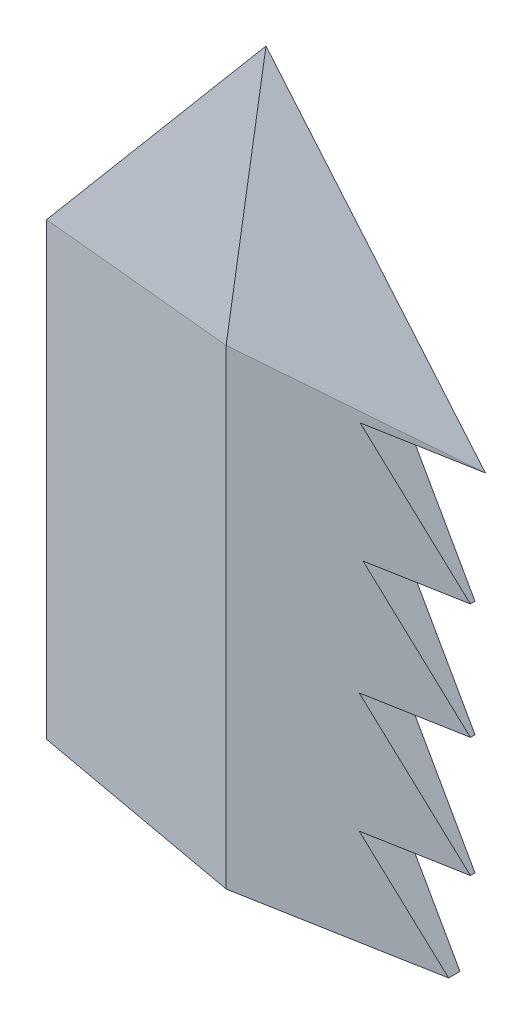
from build123d import *

# Parameters (mm, degrees)
BOSS_EXTRUDE1_DEPTH      = 9.525
BOSS_EXTRUDE1_DEPTH_BACK = 9.525
CUT_EXTRUDE1_DEPTH       = 373.680910299
CUT_EXTRUDE2_DEPTH       = 373.680910299
SKETCH5_W                = 97.518379051
SKETCH5_H                = 136.419580789
CUT_EXTRUDE3_DEPTH       = 739.741184154
SKETCH6_W                = 75.100700845
SKETCH6_H                = 154.277977479
CUT_EXTRUDE4_DEPTH       = 748.678846608
SKETCH7_R                = 4.7625
CUT_EXTRUDE5_DEPTH       = 254
CUT_EXTRUDE6_DEPTH       = 752.699804454
CUT_EXTRUDE6_DEPTH_BACK  = 752.699804454
SKETCH11_R               = 1.5875
CUT_EXTRUDE9_DEPTH       = 12.7


with BuildPart() as part:
    # Sketch1 → Boss-Extrude1 (new, two sides: drawn at the far end of the back side and taken through both)
    with BuildSketch(Plane.XY.offset(-BOSS_EXTRUDE1_DEPTH_BACK)):
        Polygon((101.792411443, 735.656458749), (49.404911443, 673.557276224), (49.404911443, 396.497366015), (154.179911443, 396.497366015), (154.179911443, 556.636391043), (128.683999881, 589.063224066), (151.148766449, 589.063224066), (128.683999881, 617.634912224), (151.148766449, 617.634912224), (129.452026088, 645.229790529), (151.148766449, 645.229790529), (128.876006433, 673.557276224), (154.179911443, 673.557276224), align=None)
    extrude(amount=BOSS_EXTRUDE1_DEPTH + BOSS_EXTRUDE1_DEPTH_BACK)

    # Sketch2 → Cut-Extrude1 (cut, through all)
    with BuildSketch(Plane(origin=(0, 396.497366015, 0), x_dir=(-1, 0, 0), z_dir=(0, -1, 0))):
        Polygon((-49.404911443, 0), (-101.792411443, -9.525), (-154.179911443, 0), (-159.65732669, 0), (-159.65732669, -13.649148588), (-44.158493861, -13.649148588), (-44.158493861, 0), align=None)
    extrude(amount=-CUT_EXTRUDE1_DEPTH, mode=Mode.SUBTRACT)

    # Sketch3 → Cut-Extrude2 (cut, through all)
    with BuildSketch(Plane.XZ.offset(-396.497366015)):
        Polygon((49.404911443, 0), (101.792411443, -9.525), (154.179911443, 0), (159.580570647, 0), (159.580570647, -14.500746269), (43.682013433, -14.500746269), (43.682013433, 0), align=None)
    extrude(amount=-CUT_EXTRUDE2_DEPTH, mode=Mode.SUBTRACT)

    # Sketch5 → Cut-Extrude3 (cut, through all)
    with BuildSketch(Plane(origin=(26.430459561, 22.297003663, 133.782021979), x_dir=(0.9815360247212257, -0.031445805879602766, -0.1886748352776165), z_dir=(0.1912773697394791, 0.16136352846789567, 0.9681811708073739))):
        with Locations((89.248369642, 700.742830845)):
            Rectangle(SKETCH5_W, SKETCH5_H)
    cut_extrude3 = extrude(amount=CUT_EXTRUDE3_DEPTH, mode=Mode.SUBTRACT)

    # Sketch6 → Cut-Extrude4 (cut, through all)
    with BuildSketch(Plane(origin=(-18.981895096, 16.01331916, 96.079914958), x_dir=(0.9815360247212258, 0.03144580587960229, 0.18867483527761636), z_dir=(-0.19127736973947887, 0.1613635284678934, 0.9681811708073744))):
        with Locations((98.873573013, 697.792784398)):
            Rectangle(SKETCH6_W, SKETCH6_H)
    cut_extrude4 = extrude(amount=CUT_EXTRUDE4_DEPTH, mode=Mode.SUBTRACT)

    # Mirror1: Cut-Extrude3, Cut-Extrude4 across plane
    add(cut_extrude3.mirror(Plane.XY), mode=Mode.SUBTRACT)
    add(cut_extrude4.mirror(Plane.XY), mode=Mode.SUBTRACT)

    # Sketch7 → Cut-Extrude5 (cut)
    with BuildSketch(Plane.XZ.offset(-396.497366015)):
        with Locations((101.792411443, 0)):
            Circle(SKETCH7_R)
    extrude(amount=-CUT_EXTRUDE5_DEPTH, mode=Mode.SUBTRACT)

    # Sketch8 → Cut-Extrude6 (cut, two sides: drawn at the far end of the back side and taken through both)
    with BuildSketch(Plane.XY.offset(-CUT_EXTRUDE6_DEPTH_BACK)):
        Polygon((101.792411443, 566.076912382), (-21.644649604, 566.076912382), (-21.644649604, 347.628500893), (201.352960681, 347.628500893), (201.352960681, 566.076912382), align=None)
    extrude(amount=CUT_EXTRUDE6_DEPTH + CUT_EXTRUDE6_DEPTH_BACK, mode=Mode.SUBTRACT)

    # Sketch11 → Cut-Extrude9 (cut)
    with BuildSketch(Plane.XZ.offset(-566.076912382)):
        with Locations((89.092411443, 0)):
            Circle(SKETCH11_R)
        with Locations((114.492411443, 0)):
            Circle(SKETCH11_R)
    extrude(amount=-CUT_EXTRUDE9_DEPTH, mode=Mode.SUBTRACT)


solid = part.part
